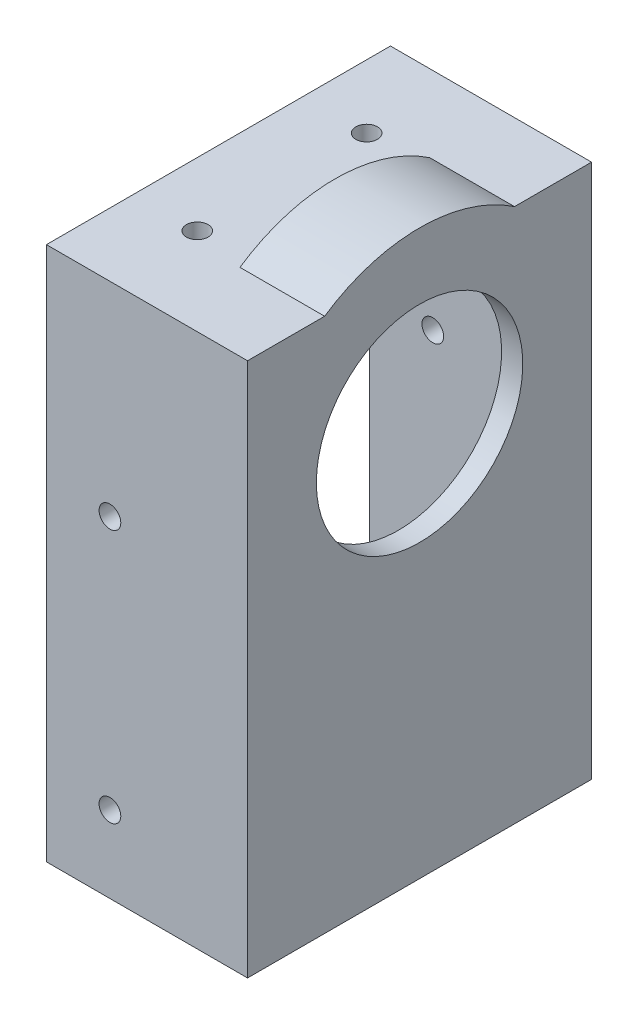
from build123d import *

# Parameters (mm, degrees)
SKETCH1_W                 = 32.5
SKETCH1_H                 = 50.5
SKETCH1_W_2               = 28.5
SKETCH1_H_2               = 46.5
EXTRUDE_THIN1_DEPTH       = 17
TAP_DRILL_FOR_M2_5_TAP1_D = 2.05
TAP_DRILL_FOR_M2_5_TAP2_D = 2.05
SKETCH7_W                 = 32.5
SKETCH7_H                 = 50.5
BOSS_EXTRUDE1_DEPTH       = 2
SKETCH9_R                 = 9.75
CUT_EXTRUDE1_DEPTH        = 2
BOSS_EXTRUDE2_DEPTH       = 8


with BuildPart() as part:
    # Sketch1 → Extrude-Thin1 (new body)
    with BuildSketch(Plane(origin=(0, 0, 0), x_dir=(0, 0, -1), z_dir=(1, 0, 0))):
        with Locations((14.25, 23.25)):
            Rectangle(SKETCH1_W, SKETCH1_H)
        with Locations((14.25, 23.25)):
            Rectangle(SKETCH1_W_2, SKETCH1_H_2, mode=Mode.SUBTRACT)
    extrude(amount=EXTRUDE_THIN1_DEPTH)

    # Tap Drill for M2.5 Tap1 (through all)
    with Locations(Plane(origin=(6, 29.25, 2), x_dir=(1, 0, 0), z_dir=(0, 0, 1))):
        with Locations((0, 0), (0, -24)):
            Hole(TAP_DRILL_FOR_M2_5_TAP1_D / 2)

    # Tap Drill for M2.5 Tap2 (through all)
    with Locations(Plane(origin=(6, 48.5, -6.25), x_dir=(0, 0, 1), z_dir=(0, 1, 0))):
        with Locations((0, 0), (-16, 0)):
            Hole(TAP_DRILL_FOR_M2_5_TAP2_D / 2)

    # Sketch7 → Boss-Extrude1 (add)
    with BuildSketch(Plane(origin=(17, 0, 0), x_dir=(0, 0, -1), z_dir=(1, 0, 0))):
        with Locations((14.25, 23.25)):
            Rectangle(SKETCH7_W, SKETCH7_H)
    extrude(amount=BOSS_EXTRUDE1_DEPTH)

    # Sketch9 → Cut-Extrude1 (cut)
    with BuildSketch(Plane.ZY.offset(-17)):
        with Locations((-14.25, 35.25)):
            Circle(SKETCH9_R)
    extrude(amount=-CUT_EXTRUDE1_DEPTH, mode=Mode.SUBTRACT)

    # Sketch10 → Boss-Extrude2 (add)
    with BuildSketch(Plane(origin=(19, 0, 0), x_dir=(0, 0, -1), z_dir=(1, 0, 0))):
        with BuildLine():
            Line((5.281304443, 48.5), (23.218695557, 48.5))
            ThreePointArc((23.218695557, 48.5), (14.25, 51.25), (5.281304443, 48.5))
        make_face()
    extrude(amount=-BOSS_EXTRUDE2_DEPTH)


solid = part.part
